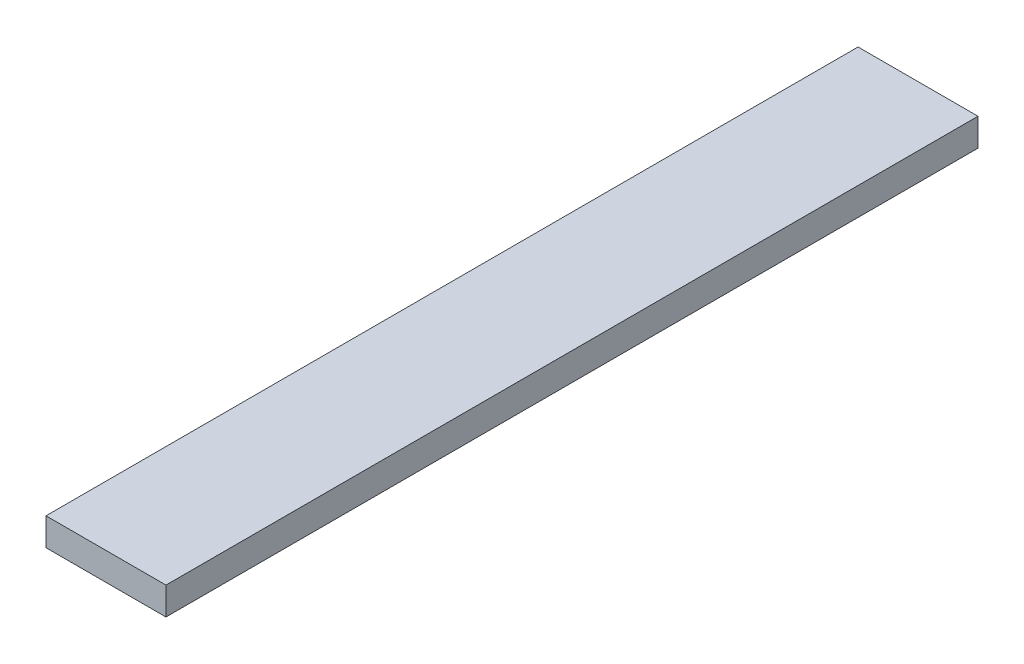
from build123d import *

# Parameters (mm, degrees)
SKETCH1_W           = 41.275
SKETCH1_H           = 9.525
BOSS_EXTRUDE1_DEPTH = 279.4


with BuildPart() as part:
    # Sketch1 → Boss-Extrude1 (new body)
    with BuildSketch(Plane.XY):
        with Locations((20.6375, 4.7625)):
            Rectangle(SKETCH1_W, SKETCH1_H)
    extrude(amount=BOSS_EXTRUDE1_DEPTH)


solid = part.part
